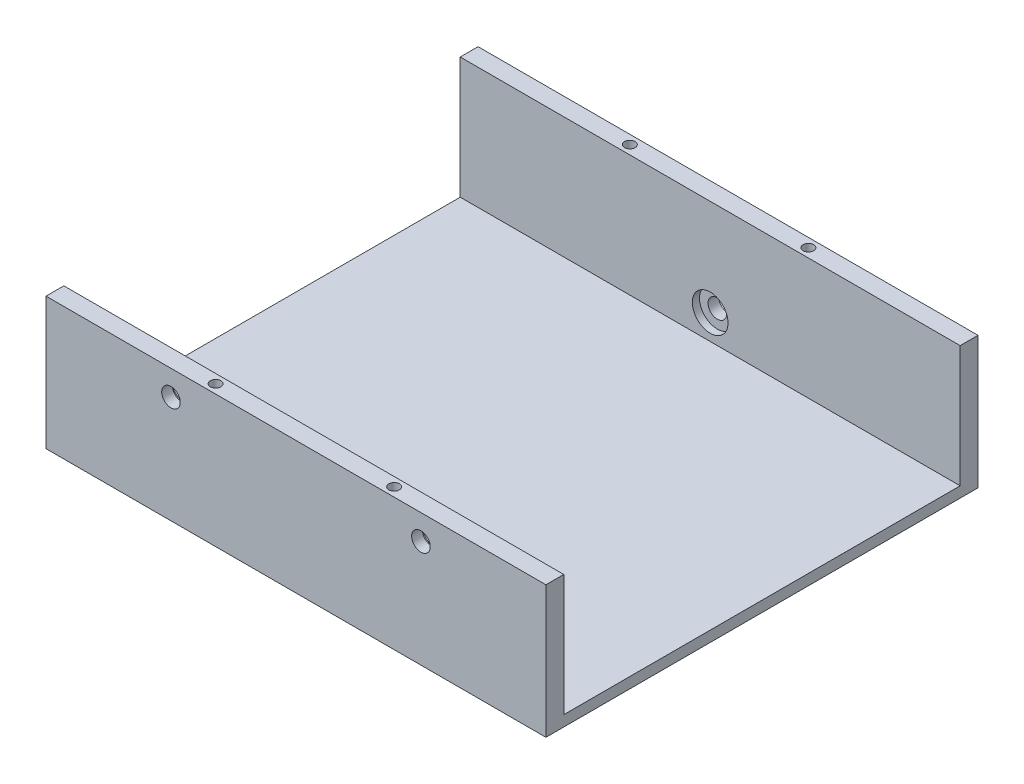
from build123d import *

# Parameters (mm, degrees)
SKETCH_1_W           = 150
SKETCH_1_H           = 123
SKETCH_1_R           = 1.5
EXTRUDE_1_DEPTH      = 3
SKETCH_2_W           = 150
SKETCH_2_H           = 6
EXTRUDE_2_DEPTH      = 17
SKETCH_3_W           = 75
SKETCH_3_H           = 6
EXTRUDE_3_DEPTH      = 37
SKETCH_4_W           = 150
SKETCH_4_H           = 111
EXTRUDE_4_DEPTH      = 3
SKETCH_6_W           = 10
SKETCH_6_H           = 123
CUT_EXTRUDE_1_DEPTH  = 50
SKETCH_7_W           = 3
SKETCH_7_H           = 101
EXTRUDE_5_DEPTH      = 17
SKETCH_9_W           = 75
SKETCH_9_H           = 6
EXTRUDE_6_DEPTH      = 37
CUT_EXTRUDE_2_DEPTH  = 37
SKETCH_12_R          = 5
CUT_EXTRUDE_3_DEPTH  = 3
CUT_EXTRUDE_5_DEPTH  = 6
SKETCH_14_R          = 5
CUT_EXTRUDE_6_DEPTH  = 3
SKETCH_15_W          = 140
SKETCH_15_H          = 3
CUT_EXTRUDE_7_DEPTH  = 6
SKETCH_17_W          = 140
SKETCH_17_H          = 6
SKETCH_17_W_2        = 3
SKETCH_17_H_2        = 101
EXTRUDE_7_DEPTH      = 17
SKETCH_19_W          = 140
SKETCH_19_H          = 1
CUT_EXTRUDE_10_DEPTH = 50
SKETCH_20_W          = 140
SKETCH_20_H          = 1
CUT_EXTRUDE_11_DEPTH = 50
SKETCH_21_W          = 3
SKETCH_21_H          = 101
CUT_EXTRUDE_12_DEPTH = 34
SKETCH_22_R          = 1.48
CUT_EXTRUDE_13_DEPTH = 10
EXTRUDE_START        = 1
SKETCH_23_R          = 5
SKETCH_23_R_2        = 2.6
EXTRUDE_8_DEPTH      = 1
SKETCH_24_R          = 5
SKETCH_24_R_2        = 2.6
EXTRUDE_9_DEPTH      = 1


with BuildPart() as part:
    # 草图1 → 凸台-拉伸1 (new body)
    with BuildSketch(Plane(origin=(0, 0, 0), x_dir=(1, 0, 0), z_dir=(0, 1, 0))):
        with Locations((75, 61.5)):
            Rectangle(SKETCH_1_W, SKETCH_1_H)
        with Locations(Location((19, 102.5, 0), (0, 0, 270))):
            Circle(SKETCH_1_R, mode=Mode.SUBTRACT)
        with Locations(Location((19, 20.5, 0), (0, 0, 270))):
            Circle(SKETCH_1_R, mode=Mode.SUBTRACT)
        with Locations(Location((141, 20.5, 0), (0, 0, 270))):
            Circle(SKETCH_1_R, mode=Mode.SUBTRACT)
        with Locations(Location((141, 102.5, 0), (0, 0, 270))):
            Circle(SKETCH_1_R, mode=Mode.SUBTRACT)
    extrude(amount=EXTRUDE_1_DEPTH)

    # 草图2 → 凸台-拉伸2 (add)
    with BuildSketch(Plane(origin=(0, 3, 0), x_dir=(1, 0, 0), z_dir=(0, 1, 0))):
        with Locations((75, 120)):
            Rectangle(SKETCH_2_W, SKETCH_2_H)
    extrude(amount=EXTRUDE_2_DEPTH)

    # 草图3 → 凸台-拉伸3 (add)
    with BuildSketch(Plane(origin=(0, 3, 0), x_dir=(1, 0, 0), z_dir=(0, 1, 0))):
        with Locations((112.5, 3)):
            Rectangle(SKETCH_3_W, SKETCH_3_H)
    extrude(amount=EXTRUDE_3_DEPTH)

    # 草图4 → 凸台-拉伸4 (add)
    with BuildSketch(Plane(origin=(0, 3, 0), x_dir=(1, 0, 0), z_dir=(0, 1, 0))):
        with Locations((75, 61.5)):
            Rectangle(SKETCH_4_W, SKETCH_4_H)
    extrude(amount=-EXTRUDE_4_DEPTH)

    # 草图6 → 切除-拉伸1 (cut)
    with BuildSketch(Plane.XZ):
        with Locations((145, -61.5)):
            Rectangle(SKETCH_6_W, SKETCH_6_H)
    extrude(amount=-CUT_EXTRUDE_1_DEPTH, mode=Mode.SUBTRACT)

    # 草图7 → 凸台-拉伸5 (add)
    with BuildSketch(Plane(origin=(0, 3, 0), x_dir=(1, 0, 0), z_dir=(0, 1, 0))):
        with Locations((1.5, 56.5)):
            Rectangle(SKETCH_7_W, SKETCH_7_H)
    extrude(amount=EXTRUDE_5_DEPTH)

    # 草图9 → 凸台-拉伸6 (add)
    with BuildSketch(Plane(origin=(0, 3, 0), x_dir=(1, 0, 0), z_dir=(0, 1, 0))):
        with Locations((37.5, 3)):
            Rectangle(SKETCH_9_W, SKETCH_9_H)
    extrude(amount=EXTRUDE_6_DEPTH)

    # 草图11 → 切除-拉伸2 (cut)
    with BuildSketch(Plane(origin=(0, 0, -6), x_dir=(-1, 0, 0), z_dir=(0, 0, -1))):
        with BuildLine():
            ThreePointArc((-107.6, 30), (-105, 27.4), (-102.4, 30))
            Line((-102.4, 30), (-107.6, 30))
        make_face()
        with BuildLine():
            Line((-107.6, 30), (-102.4, 30))
            ThreePointArc((-102.4, 30), (-105, 32.6), (-107.6, 30))
        make_face()
        with BuildLine():
            ThreePointArc((-32.4, 30), (-35, 32.6), (-37.6, 30))
            Line((-37.6, 30), (-32.4, 30))
        make_face()
        with BuildLine():
            Line((-32.4, 30), (-37.6, 30))
            ThreePointArc((-37.6, 30), (-35, 27.4), (-32.4, 30))
        make_face()
    extrude(amount=-CUT_EXTRUDE_2_DEPTH, mode=Mode.SUBTRACT)

    # 草图12 → 切除-拉伸3 (cut)
    with BuildSketch(Plane(origin=(0, 0, -6), x_dir=(-1, 0, 0), z_dir=(0, 0, -1))):
        with Locations((-105, 30)):
            Circle(SKETCH_12_R)
        with Locations((-35, 30)):
            Circle(SKETCH_12_R)
    extrude(amount=-CUT_EXTRUDE_3_DEPTH, mode=Mode.SUBTRACT)

    # 草图13 → 切除-拉伸5 (cut)
    with BuildSketch(Plane.XY.offset(-117)):
        with BuildLine():
            ThreePointArc((67.4, 10), (70, 7.4), (72.6, 10))
            Line((72.6, 10), (67.4, 10))
        make_face()
        with BuildLine():
            Line((67.4, 10), (72.6, 10))
            ThreePointArc((72.6, 10), (70, 12.6), (67.4, 10))
        make_face()
    extrude(amount=-CUT_EXTRUDE_5_DEPTH, mode=Mode.SUBTRACT)

    # 草图14 → 切除-拉伸6 (cut)
    with BuildSketch(Plane.XY.offset(-117)):
        with Locations((70, 10)):
            Circle(SKETCH_14_R)
    extrude(amount=-CUT_EXTRUDE_6_DEPTH, mode=Mode.SUBTRACT)

    # 草图15 → 切除-拉伸7 (cut)
    with BuildSketch(Plane.XY):
        with Locations((70, 38.5)):
            Rectangle(SKETCH_15_W, SKETCH_15_H)
    extrude(amount=-CUT_EXTRUDE_7_DEPTH, mode=Mode.SUBTRACT)

    # 草图17 → 凸台-拉伸7 (add)
    with BuildSketch(Plane(origin=(0, 20, 0), x_dir=(1, 0, 0), z_dir=(0, 1, 0))):
        with Locations((70, 120)):
            Rectangle(SKETCH_17_W, SKETCH_17_H)
        with Locations((1.5, 56.5)):
            Rectangle(SKETCH_17_W_2, SKETCH_17_H_2)
    extrude(amount=EXTRUDE_7_DEPTH)

    # 草图19 → 切除-拉伸10 (cut)
    with BuildSketch(Plane(origin=(0, 37, 0), x_dir=(1, 0, 0), z_dir=(0, 1, 0))):
        with Locations((70, 122.5)):
            Rectangle(SKETCH_19_W, SKETCH_19_H)
    extrude(amount=-CUT_EXTRUDE_10_DEPTH, mode=Mode.SUBTRACT)

    # 草图20 → 切除-拉伸11 (cut)
    with BuildSketch(Plane(origin=(0, 37, 0), x_dir=(1, 0, 0), z_dir=(0, 1, 0))):
        with Locations((70, 0.5)):
            Rectangle(SKETCH_20_W, SKETCH_20_H)
    extrude(amount=-CUT_EXTRUDE_11_DEPTH, mode=Mode.SUBTRACT)

    # 草图21 → 切除-拉伸12 (cut)
    with BuildSketch(Plane(origin=(0, 37, 0), x_dir=(1, 0, 0), z_dir=(0, 1, 0))):
        with Locations((1.5, 56.5)):
            Rectangle(SKETCH_21_W, SKETCH_21_H)
    extrude(amount=-CUT_EXTRUDE_12_DEPTH, mode=Mode.SUBTRACT)

    # 草图22 → 切除-拉伸13 (cut)
    with BuildSketch(Plane(origin=(0, 37, 0), x_dir=(1, 0, 0), z_dir=(0, 1, 0))):
        with Locations(Location((95, 119.5, 0), (0, 0, 270))):
            Circle(SKETCH_22_R)
        with Locations(Location((45, 119.5, 0), (0, 0, 270))):
            Circle(SKETCH_22_R)
        with Locations(Location((45, 3.5, 0), (0, 0, 270))):
            Circle(SKETCH_22_R)
        with Locations(Location((95, 3.5, 0), (0, 0, 270))):
            Circle(SKETCH_22_R)
    extrude(amount=-CUT_EXTRUDE_13_DEPTH, mode=Mode.SUBTRACT)

    # 草图23 → 凸台-拉伸8 (add)
    with BuildSketch(Plane.XY.offset(-120).offset(EXTRUDE_START)):
        with Locations((70, 10)):
            Circle(SKETCH_23_R)
        with Locations((70, 10)):
            Circle(SKETCH_23_R_2, mode=Mode.SUBTRACT)
    extrude(amount=-EXTRUDE_8_DEPTH)

    # 草图24 → 凸台-拉伸9 (add)
    # profile 1 of 2: a face of its own
    with BuildSketch(Plane(origin=(0, 0, -3), x_dir=(-1, 0, 0), z_dir=(0, 0, -1)).offset(EXTRUDE_START)):
        with Locations((-105, 30)):
            Circle(SKETCH_24_R)
        with Locations((-105, 30)):
            Circle(SKETCH_24_R_2, mode=Mode.SUBTRACT)
    # profile 2 of 2: a face of its own
    with BuildSketch(Plane(origin=(0, 0, -3), x_dir=(-1, 0, 0), z_dir=(0, 0, -1)).offset(EXTRUDE_START)):
        with Locations((-35, 30)):
            Circle(SKETCH_24_R)
        with Locations((-35, 30)):
            Circle(SKETCH_24_R_2, mode=Mode.SUBTRACT)
    extrude(amount=-EXTRUDE_9_DEPTH)


solid = part.part
